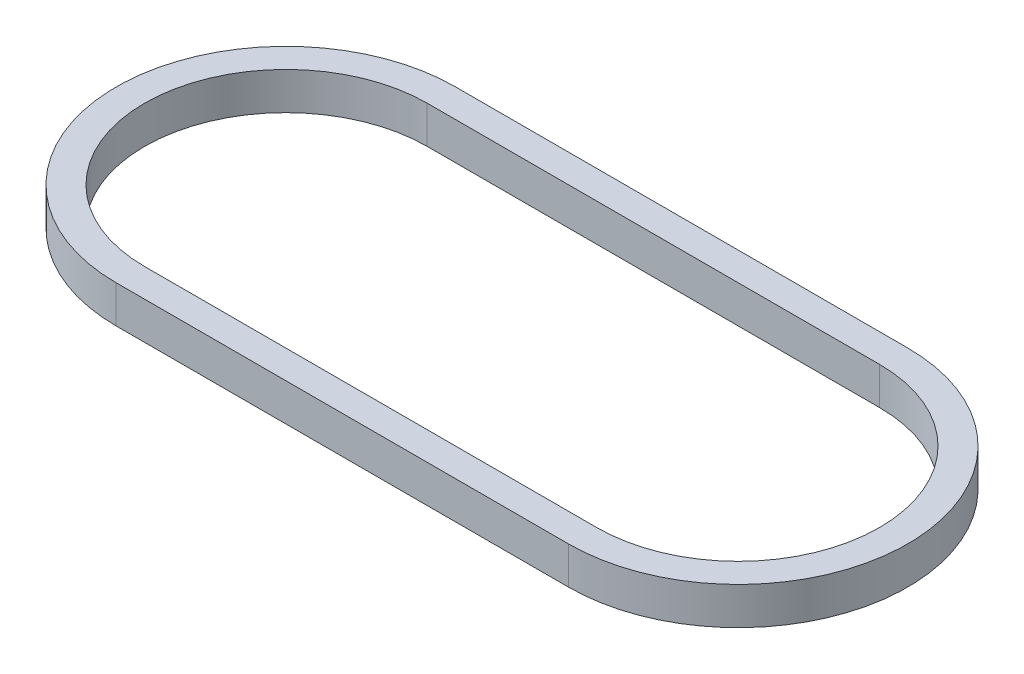
from build123d import *

# Parameters (mm, degrees)
BOSS_EXTRUDE1_DEPTH = 7.7978


with BuildPart() as part:
    # Sketch1 → Boss-Extrude1 (new body)
    with BuildSketch(Plane(origin=(0, 0, 0), x_dir=(1, 0, 0), z_dir=(0, 1, 0))):
        with BuildLine():
            Line((-47.1, -35.3387), (47.1, -35.3387))
            ThreePointArc((47.1, -35.3387), (82.4387, 0), (47.1, 35.3387))
            Line((47.1, 35.3387), (-47.1, 35.3387))
            ThreePointArc((-47.1, 35.3387), (-82.4387, 0), (-47.1, -35.3387))
        make_face()
        with BuildLine():
            Line((-47.1, -29.4459), (47.1, -29.4459))
            ThreePointArc((47.1, -29.4459), (76.5459, 0), (47.1, 29.4459))
            Line((47.1, 29.4459), (-47.1, 29.4459))
            ThreePointArc((-47.1, 29.4459), (-76.5459, 0), (-47.1, -29.4459))
        make_face(mode=Mode.SUBTRACT)
    extrude(amount=BOSS_EXTRUDE1_DEPTH)


solid = part.part
